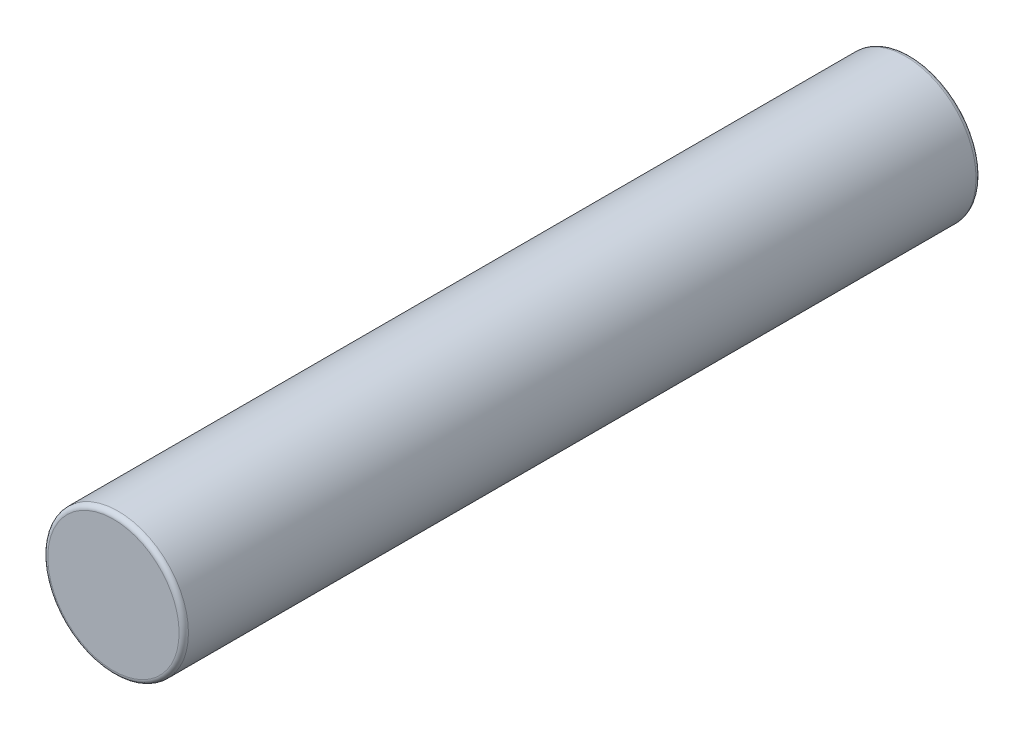
from build123d import *

# Parameters (mm, degrees)
SKETCH1_R           = 3
BOSS_EXTRUDE1_DEPTH = 34
FILLET1_R           = 0.2


with BuildPart() as part:
    # Sketch1 → Boss-Extrude1 (new body)
    with BuildSketch(Plane.XY):
        Circle(SKETCH1_R)
    extrude(amount=BOSS_EXTRUDE1_DEPTH)

    # Fillet1
    fillet1_edges = [part.edges().sort_by_distance(p)[0] for p in [
        (-3, 0, 0),
        (-3, 0, 34),
    ]]
    fillet(fillet1_edges, radius=FILLET1_R)


solid = part.part
